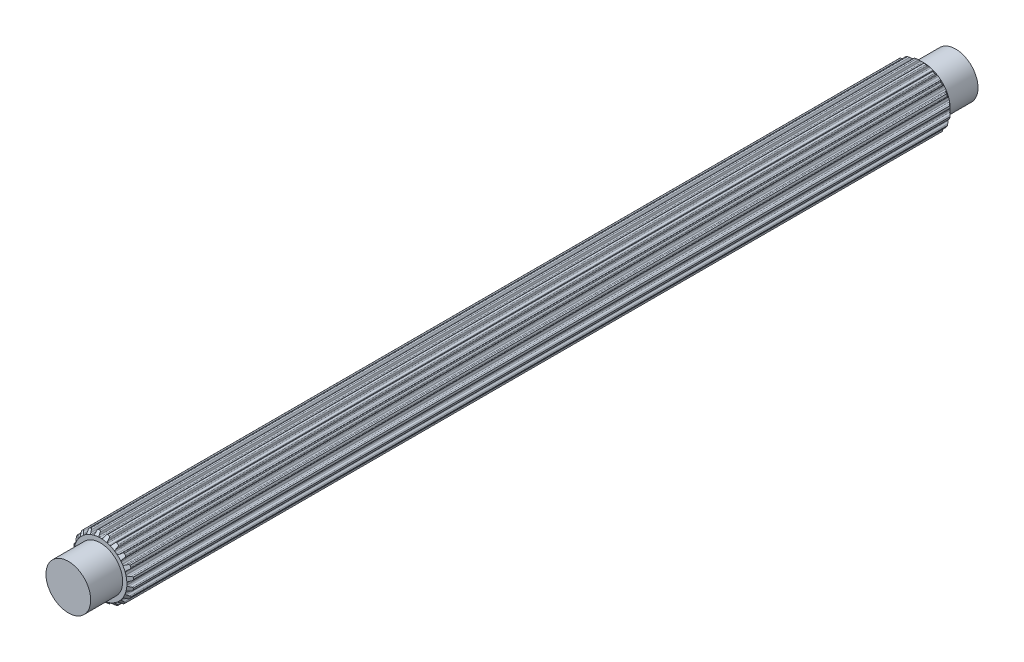
from build123d import *

# Parameters (mm, degrees)
BOSS_EXTRUDE1_DEPTH = 46.04766
SKETCH2_R           = 2.5019
BOSS_EXTRUDE2_DEPTH = 49.62906


with BuildPart() as part:
    # Sketch1 → Boss-Extrude1 (new, symmetric)
    with BuildSketch(Plane.XY):
        with BuildLine():
            Line((-0.106949245, 2.969874934), (0.106949245, 2.969874934))
            ThreePointArc((0.106949245, 2.969874934), (0.196343213, 2.986924176), (0.253739238, 3.057547504))
            Line((0.253739238, 3.057547504), (0.315888147, 3.237526941))
            ThreePointArc((0.315888147, 3.237526941), (0.359032156, 3.298322911), (0.4281449, 3.326269005))
            Line((0.4281449, 3.326269005), (0.620027588, 3.2937547))
            ThreePointArc((0.620027588, 3.2937547), (0.689621142, 3.24802576), (0.718272212, 3.169836791))
            Line((0.718272212, 3.169836791), (0.724389167, 2.979527391))
            ThreePointArc((0.724389167, 2.979527391), (0.750934762, 2.9040661), (0.816027049, 2.857568043))
            Line((0.816027049, 2.857568043), (1.019456602, 2.791469774))
            ThreePointArc((1.019456602, 2.791469774), (1.109743823, 2.780060312), (1.186154496, 2.829490741))
            Line((1.186154496, 2.829490741), (1.300878326, 2.981456288))
            ThreePointArc((1.300878326, 2.981456288), (1.360697704, 3.02594446), (1.435063648, 3.031165762))
            Line((1.435063648, 3.031165762), (1.607507455, 2.940947809))
            ThreePointArc((1.607507455, 2.940947809), (1.659563839, 2.875951412), (1.662650905, 2.792735615))
            Line((1.662650905, 2.792735615), (1.609659636, 2.609850378))
            ThreePointArc((1.609659636, 2.609850378), (1.611587176, 2.529879385), (1.659124931, 2.465542482))
            Line((1.659124931, 2.465542482), (1.832172444, 2.339816104))
            ThreePointArc((1.832172444, 2.339816104), (1.914514976, 2.301064775), (2.002460687, 2.32446371))
            Line((2.002460687, 2.32446371), (2.158529469, 2.433539921))
            ThreePointArc((2.158529469, 2.433539921), (2.229168681, 2.457365482), (2.301508367, 2.439350895))
            Line((2.301508367, 2.439350895), (2.437633293, 2.300260456))
            ThreePointArc((2.437633293, 2.300260456), (2.467056864, 2.222358901), (2.444277744, 2.14226202))
            Line((2.444277744, 2.14226202), (2.337365406, 1.984703026))
            ThreePointArc((2.337365406, 1.984703026), (2.314486209, 1.908050449), (2.339816104, 1.832172444))
            Line((2.339816104, 1.832172444), (2.465542482, 1.659124931))
            ThreePointArc((2.465542482, 1.659124931), (2.531880064, 1.596824985), (2.622752074, 1.591901975))
            Line((2.622752074, 1.591901975), (2.804888709, 1.64741171))
            ThreePointArc((2.804888709, 1.64741171), (2.879433095, 1.648242449), (2.942665411, 1.608755366))
            Line((2.942665411, 1.608755366), (3.0291466, 1.434407582))
            ThreePointArc((3.0291466, 1.434407582), (3.033057175, 1.351226417), (2.986641646, 1.282088892))
            Line((2.986641646, 1.282088892), (2.836273564, 1.165279113))
            ThreePointArc((2.836273564, 1.165279113), (2.790827206, 1.099448241), (2.791469774, 1.019456602))
            Line((2.791469774, 1.019456602), (2.857568043, 0.816027049))
            ThreePointArc((2.857568043, 0.816027049), (2.901407091, 0.736276839), (2.986310214, 0.703513784))
            Line((2.986310214, 0.703513784), (3.1766859, 0.700023363))
            ThreePointArc((3.1766859, 0.700023363), (3.247838536, 0.677777961), (3.295773863, 0.620683653))
            Line((3.295773863, 0.620683653), (3.324145932, 0.4281449))
            ThreePointArc((3.324145932, 0.4281449), (3.302160717, 0.347826477), (3.236652255, 0.29641597))
            Line((3.236652255, 0.29641597), (3.057547504, 0.231789562))
            ThreePointArc((3.057547504, 0.231789562), (2.993982591, 0.183224379), (2.969874934, 0.106949245))
            Line((2.969874934, 0.106949245), (2.969874934, -0.106949245))
            ThreePointArc((2.969874934, -0.106949245), (2.986924176, -0.196343213), (3.057547504, -0.253739238))
            Line((3.057547504, -0.253739238), (3.237526941, -0.315888147))
            ThreePointArc((3.237526941, -0.315888147), (3.298322911, -0.359032156), (3.326269005, -0.4281449))
            Line((3.326269005, -0.4281449), (3.2937547, -0.620027588))
            ThreePointArc((3.2937547, -0.620027588), (3.24802576, -0.689621142), (3.169836791, -0.718272212))
            Line((3.169836791, -0.718272212), (2.979527391, -0.724389167))
            ThreePointArc((2.979527391, -0.724389167), (2.9040661, -0.750934762), (2.857568043, -0.816027049))
            Line((2.857568043, -0.816027049), (2.791469774, -1.019456602))
            ThreePointArc((2.791469774, -1.019456602), (2.780060312, -1.109743823), (2.829490741, -1.186154496))
            Line((2.829490741, -1.186154496), (2.981456288, -1.300878326))
            ThreePointArc((2.981456288, -1.300878326), (3.02594446, -1.360697704), (3.031165762, -1.435063648))
            Line((3.031165762, -1.435063648), (2.940947809, -1.607507455))
            ThreePointArc((2.940947809, -1.607507455), (2.875951412, -1.659563839), (2.792735615, -1.662650905))
            Line((2.792735615, -1.662650905), (2.609850378, -1.609659636))
            ThreePointArc((2.609850378, -1.609659636), (2.529879385, -1.611587176), (2.465542482, -1.659124931))
            Line((2.465542482, -1.659124931), (2.339816104, -1.832172444))
            ThreePointArc((2.339816104, -1.832172444), (2.301064775, -1.914514976), (2.32446371, -2.002460687))
            Line((2.32446371, -2.002460687), (2.433539921, -2.158529469))
            ThreePointArc((2.433539921, -2.158529469), (2.457365482, -2.229168681), (2.439350895, -2.301508367))
            Line((2.439350895, -2.301508367), (2.300260456, -2.437633293))
            ThreePointArc((2.300260456, -2.437633293), (2.222358901, -2.467056864), (2.14226202, -2.444277744))
            Line((2.14226202, -2.444277744), (1.984703026, -2.337365406))
            ThreePointArc((1.984703026, -2.337365406), (1.908050449, -2.314486209), (1.832172444, -2.339816104))
            Line((1.832172444, -2.339816104), (1.659124931, -2.465542482))
            ThreePointArc((1.659124931, -2.465542482), (1.596824985, -2.531880064), (1.591901975, -2.622752074))
            Line((1.591901975, -2.622752074), (1.64741171, -2.804888709))
            ThreePointArc((1.64741171, -2.804888709), (1.648242449, -2.879433095), (1.608755366, -2.942665411))
            Line((1.608755366, -2.942665411), (1.434407582, -3.0291466))
            ThreePointArc((1.434407582, -3.0291466), (1.351226417, -3.033057175), (1.282088892, -2.986641646))
            Line((1.282088892, -2.986641646), (1.165279113, -2.836273564))
            ThreePointArc((1.165279113, -2.836273564), (1.099448241, -2.790827206), (1.019456602, -2.791469774))
            Line((1.019456602, -2.791469774), (0.816027049, -2.857568043))
            ThreePointArc((0.816027049, -2.857568043), (0.736276839, -2.901407091), (0.703513784, -2.986310214))
            Line((0.703513784, -2.986310214), (0.700023363, -3.1766859))
            ThreePointArc((0.700023363, -3.1766859), (0.677777961, -3.247838536), (0.620683653, -3.295773863))
            Line((0.620683653, -3.295773863), (0.4281449, -3.324145932))
            ThreePointArc((0.4281449, -3.324145932), (0.347826477, -3.302160717), (0.29641597, -3.236652255))
            Line((0.29641597, -3.236652255), (0.231789562, -3.057547504))
            ThreePointArc((0.231789562, -3.057547504), (0.183224379, -2.993982591), (0.106949245, -2.969874934))
            Line((0.106949245, -2.969874934), (-0.106949245, -2.969874934))
            ThreePointArc((-0.106949245, -2.969874934), (-0.196343213, -2.986924176), (-0.253739238, -3.057547504))
            Line((-0.253739238, -3.057547504), (-0.315888147, -3.237526941))
            ThreePointArc((-0.315888147, -3.237526941), (-0.359032156, -3.298322911), (-0.4281449, -3.326269005))
            Line((-0.4281449, -3.326269005), (-0.620027588, -3.2937547))
            ThreePointArc((-0.620027588, -3.2937547), (-0.689621142, -3.24802576), (-0.718272212, -3.169836791))
            Line((-0.718272212, -3.169836791), (-0.724389167, -2.979527391))
            ThreePointArc((-0.724389167, -2.979527391), (-0.750934762, -2.9040661), (-0.816027049, -2.857568043))
            Line((-0.816027049, -2.857568043), (-1.019456602, -2.791469774))
            ThreePointArc((-1.019456602, -2.791469774), (-1.109743823, -2.780060312), (-1.186154496, -2.829490741))
            Line((-1.186154496, -2.829490741), (-1.300878326, -2.981456288))
            ThreePointArc((-1.300878326, -2.981456288), (-1.360697704, -3.02594446), (-1.435063648, -3.031165762))
            Line((-1.435063648, -3.031165762), (-1.607507455, -2.940947809))
            ThreePointArc((-1.607507455, -2.940947809), (-1.659563839, -2.875951412), (-1.662650905, -2.792735615))
            Line((-1.662650905, -2.792735615), (-1.609659636, -2.609850378))
            ThreePointArc((-1.609659636, -2.609850378), (-1.611587176, -2.529879385), (-1.659124931, -2.465542482))
            Line((-1.659124931, -2.465542482), (-1.832172444, -2.339816104))
            ThreePointArc((-1.832172444, -2.339816104), (-1.914514976, -2.301064775), (-2.002460687, -2.32446371))
            Line((-2.002460687, -2.32446371), (-2.158529469, -2.433539921))
            ThreePointArc((-2.158529469, -2.433539921), (-2.229168681, -2.457365482), (-2.301508367, -2.439350895))
            Line((-2.301508367, -2.439350895), (-2.437633293, -2.300260456))
            ThreePointArc((-2.437633293, -2.300260456), (-2.467056864, -2.222358901), (-2.444277744, -2.14226202))
            Line((-2.444277744, -2.14226202), (-2.337365406, -1.984703026))
            ThreePointArc((-2.337365406, -1.984703026), (-2.314486209, -1.908050449), (-2.339816104, -1.832172444))
            Line((-2.339816104, -1.832172444), (-2.465542482, -1.659124931))
            ThreePointArc((-2.465542482, -1.659124931), (-2.531880064, -1.596824985), (-2.622752074, -1.591901975))
            Line((-2.622752074, -1.591901975), (-2.804888709, -1.64741171))
            ThreePointArc((-2.804888709, -1.64741171), (-2.879433095, -1.648242449), (-2.942665411, -1.608755366))
            Line((-2.942665411, -1.608755366), (-3.0291466, -1.434407582))
            ThreePointArc((-3.0291466, -1.434407582), (-3.033057175, -1.351226417), (-2.986641646, -1.282088892))
            Line((-2.986641646, -1.282088892), (-2.836273564, -1.165279113))
            ThreePointArc((-2.836273564, -1.165279113), (-2.790827206, -1.099448241), (-2.791469774, -1.019456602))
            Line((-2.791469774, -1.019456602), (-2.857568043, -0.816027049))
            ThreePointArc((-2.857568043, -0.816027049), (-2.901407091, -0.736276839), (-2.986310214, -0.703513784))
            Line((-2.986310214, -0.703513784), (-3.1766859, -0.700023363))
            ThreePointArc((-3.1766859, -0.700023363), (-3.247838536, -0.677777961), (-3.295773863, -0.620683653))
            Line((-3.295773863, -0.620683653), (-3.324145932, -0.4281449))
            ThreePointArc((-3.324145932, -0.4281449), (-3.302160717, -0.347826477), (-3.236652255, -0.29641597))
            Line((-3.236652255, -0.29641597), (-3.057547504, -0.231789562))
            ThreePointArc((-3.057547504, -0.231789562), (-2.993982591, -0.183224379), (-2.969874934, -0.106949245))
            Line((-2.969874934, -0.106949245), (-2.969874934, 0.106949245))
            ThreePointArc((-2.969874934, 0.106949245), (-2.986924176, 0.196343213), (-3.057547504, 0.253739238))
            Line((-3.057547504, 0.253739238), (-3.237526941, 0.315888147))
            ThreePointArc((-3.237526941, 0.315888147), (-3.298322911, 0.359032156), (-3.326269005, 0.4281449))
            Line((-3.326269005, 0.4281449), (-3.2937547, 0.620027588))
            ThreePointArc((-3.2937547, 0.620027588), (-3.24802576, 0.689621142), (-3.169836791, 0.718272212))
            Line((-3.169836791, 0.718272212), (-2.979527391, 0.724389167))
            ThreePointArc((-2.979527391, 0.724389167), (-2.9040661, 0.750934762), (-2.857568043, 0.816027049))
            Line((-2.857568043, 0.816027049), (-2.791469774, 1.019456602))
            ThreePointArc((-2.791469774, 1.019456602), (-2.780060312, 1.109743823), (-2.829490741, 1.186154496))
            Line((-2.829490741, 1.186154496), (-2.981456288, 1.300878326))
            ThreePointArc((-2.981456288, 1.300878326), (-3.02594446, 1.360697704), (-3.031165762, 1.435063648))
            Line((-3.031165762, 1.435063648), (-2.940947809, 1.607507455))
            ThreePointArc((-2.940947809, 1.607507455), (-2.875951412, 1.659563839), (-2.792735615, 1.662650905))
            Line((-2.792735615, 1.662650905), (-2.609850378, 1.609659636))
            ThreePointArc((-2.609850378, 1.609659636), (-2.529879385, 1.611587176), (-2.465542482, 1.659124931))
            Line((-2.465542482, 1.659124931), (-2.339816104, 1.832172444))
            ThreePointArc((-2.339816104, 1.832172444), (-2.301064775, 1.914514976), (-2.32446371, 2.002460687))
            Line((-2.32446371, 2.002460687), (-2.433539921, 2.158529469))
            ThreePointArc((-2.433539921, 2.158529469), (-2.457365482, 2.229168681), (-2.439350895, 2.301508367))
            Line((-2.439350895, 2.301508367), (-2.300260456, 2.437633293))
            ThreePointArc((-2.300260456, 2.437633293), (-2.222358901, 2.467056864), (-2.14226202, 2.444277744))
            Line((-2.14226202, 2.444277744), (-1.984703026, 2.337365406))
            ThreePointArc((-1.984703026, 2.337365406), (-1.908050449, 2.314486209), (-1.832172444, 2.339816104))
            Line((-1.832172444, 2.339816104), (-1.659124931, 2.465542482))
            ThreePointArc((-1.659124931, 2.465542482), (-1.596824985, 2.531880064), (-1.591901975, 2.622752074))
            Line((-1.591901975, 2.622752074), (-1.64741171, 2.804888709))
            ThreePointArc((-1.64741171, 2.804888709), (-1.648242449, 2.879433095), (-1.608755366, 2.942665411))
            Line((-1.608755366, 2.942665411), (-1.434407582, 3.0291466))
            ThreePointArc((-1.434407582, 3.0291466), (-1.351226417, 3.033057175), (-1.282088892, 2.986641646))
            Line((-1.282088892, 2.986641646), (-1.165279113, 2.836273564))
            ThreePointArc((-1.165279113, 2.836273564), (-1.099448241, 2.790827206), (-1.019456602, 2.791469774))
            Line((-1.019456602, 2.791469774), (-0.816027049, 2.857568043))
            ThreePointArc((-0.816027049, 2.857568043), (-0.736276839, 2.901407091), (-0.703513784, 2.986310214))
            Line((-0.703513784, 2.986310214), (-0.700023363, 3.1766859))
            ThreePointArc((-0.700023363, 3.1766859), (-0.677777961, 3.247838536), (-0.620683653, 3.295773863))
            Line((-0.620683653, 3.295773863), (-0.4281449, 3.324145932))
            ThreePointArc((-0.4281449, 3.324145932), (-0.347826477, 3.302160717), (-0.29641597, 3.236652255))
            Line((-0.29641597, 3.236652255), (-0.231789562, 3.057547504))
            ThreePointArc((-0.231789562, 3.057547504), (-0.183224379, 2.993982591), (-0.106949245, 2.969874934))
        make_face()
    extrude(amount=BOSS_EXTRUDE1_DEPTH, both=True)

    # Sketch2 → Boss-Extrude2 (add, symmetric)
    with BuildSketch(Plane.XY):
        Circle(SKETCH2_R)
    extrude(amount=BOSS_EXTRUDE2_DEPTH, both=True)

    # Sketch3 → Cut-Revolve1 (revolve, cut)
    with BuildSketch(Plane(origin=(0, 0, 0), x_dir=(0, 0, -1), z_dir=(1, 0, 0))):
        Polygon((-44.916435505, 4.101099429), (-46.04766, 2.969874934), (-46.04766, 4.101099429), align=None)
        Polygon((46.04766, 42.761529155), (46.04766, 2.969874934), (26.151832889, 22.865702045), align=None)
    revolve(axis=Axis((0, 0, 14.360793934), (0, 0, -1)), mode=Mode.SUBTRACT)


solid = part.part
